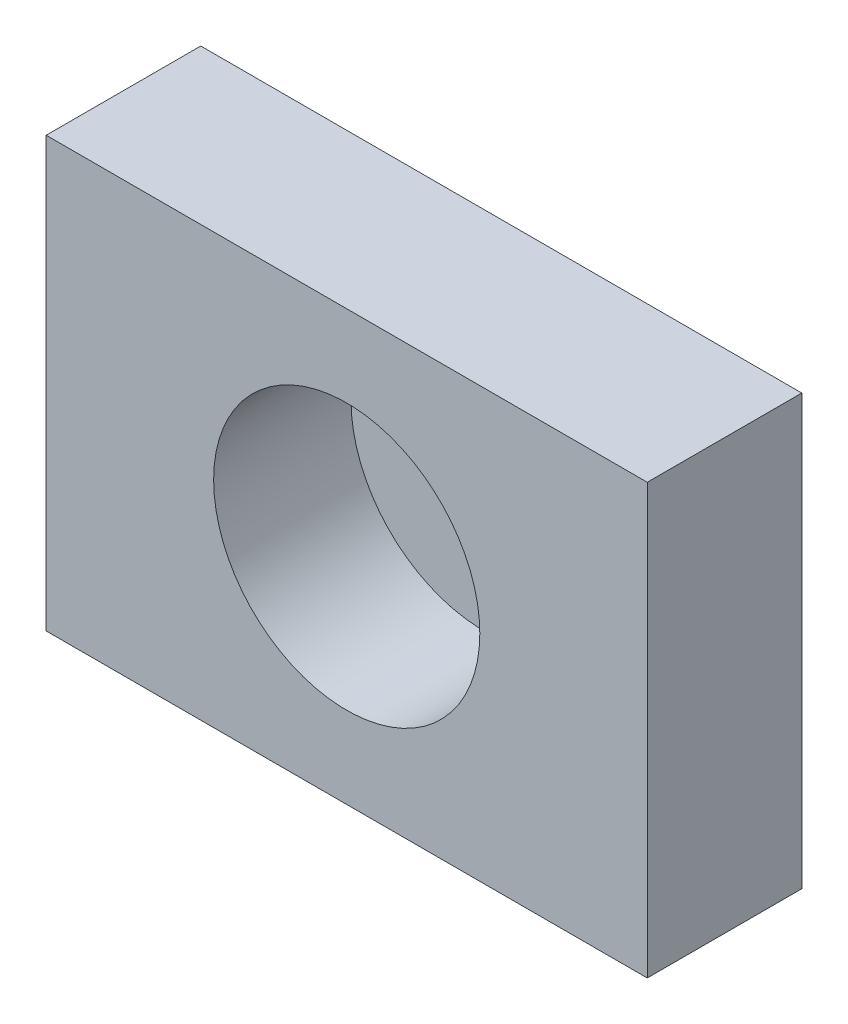
from build123d import *

# Parameters (mm, degrees)
SKETCH_1_W      = 70
SKETCH_1_H      = 50
SKETCH_1_R      = 15.5
EXTRUDE_1_DEPTH = 18
SKETCH_2_R      = 15.5
EXTRUDE_2_DEPTH = 2


with BuildPart() as part:
    # 草图1 → 凸台-拉伸1 (new body)
    with BuildSketch(Plane.XY):
        with Locations((35, 25)):
            Rectangle(SKETCH_1_W, SKETCH_1_H)
        with Locations((35, 25)):
            Circle(SKETCH_1_R, mode=Mode.SUBTRACT)
    extrude(amount=EXTRUDE_1_DEPTH)

    # 草图2 → 凸台-拉伸2 (add)
    with BuildSketch(Plane.XY):
        with Locations((35, 25)):
            Circle(SKETCH_2_R)
    extrude(amount=EXTRUDE_2_DEPTH)


solid = part.part
